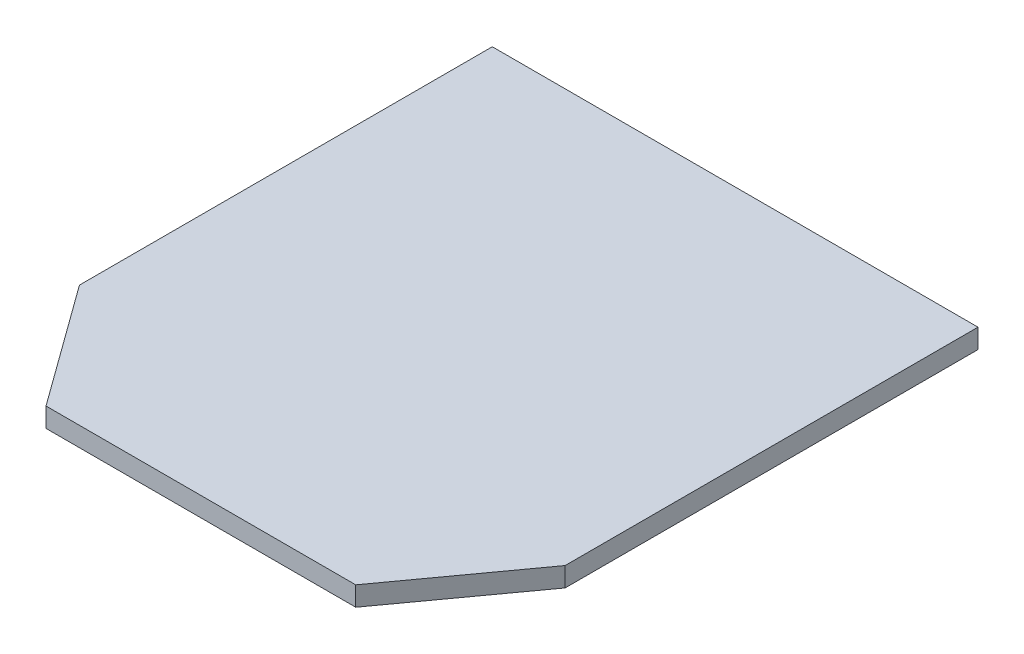
from build123d import *

# Parameters (mm, degrees)
SKETCH1_W           = 100
SKETCH1_H           = 85
BOSS_EXTRUDE1_DEPTH = 4


with BuildPart() as part:
    # Sketch1 → Boss-Extrude1 (new body)
    with BuildSketch(Plane(origin=(0, 0, 0), x_dir=(1, 0, 0), z_dir=(0, 1, 0))):
        Polygon((-45.143769968, -85), (54.856230032, -85), (36.741214058, -110), (-27.028753994, -110), align=None)
        with Locations((4.856230032, -42.5)):
            Rectangle(SKETCH1_W, SKETCH1_H)
    extrude(amount=BOSS_EXTRUDE1_DEPTH)


solid = part.part
